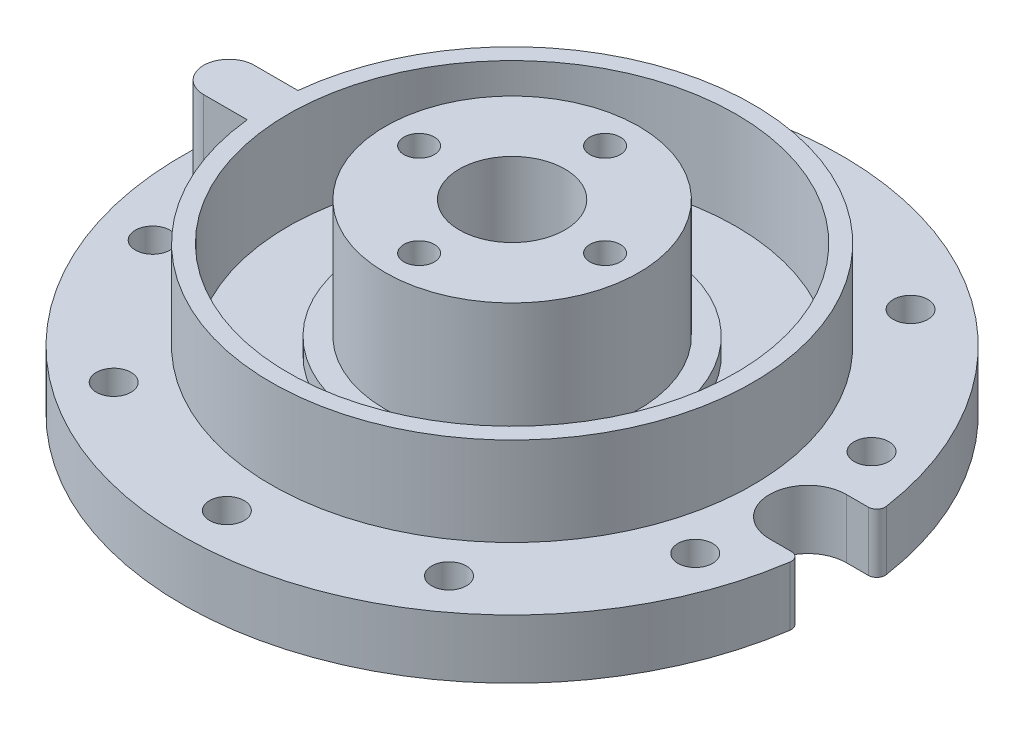
from build123d import *

# Parameters (mm, degrees)
SKETCH1_R                                           = 39
BOSS_EXTRUDE1_DEPTH                                 = 7
SKETCH3_R                                           = 17.5
BOSS_EXTRUDE2_DEPTH                                 = 1
SKETCH4_R                                           = 15
BOSS_EXTRUDE3_DEPTH                                 = 14
SKETCH5_R                                           = 6.25
SKETCH5_R_2                                         = 1.8
CUT_EXTRUDE1_DEPTH                                  = 60.380131357
CSK_FOR_M4_COUNTERSUNK_FLAT_HEAD_SCREW1_D           = 3.5
CSK_FOR_M4_COUNTERSUNK_FLAT_HEAD_SCREW1_CSINK_D     = 9.1
CSK_FOR_M4_COUNTERSUNK_FLAT_HEAD_SCREW1_CSINK_ANGLE = 90
SKETCH7_R                                           = 28.5
SKETCH7_R_2                                         = 26.5
BOSS_EXTRUDE4_DEPTH                                 = 10.5
CUT_EXTRUDE2_START                                  = -1
SKETCH8_R                                           = 26.5
SKETCH8_R_2                                         = 17.5
CUT_EXTRUDE2_DEPTH                                  = 1
SKETCH9_R                                           = 2.05
CUT_EXTRUDE3_DEPTH                                  = 58.157676676
BOSS_EXTRUDE5_DEPTH                                 = 10.5
CUT_EXTRUDE4_DEPTH                                  = 58.157676676
FILLET1_R                                           = 1


with BuildPart() as part:
    # Sketch1 → Boss-Extrude1 (new body)
    with BuildSketch(Plane(origin=(0, 0, 0), x_dir=(1, 0, 0), z_dir=(0, 1, 0))):
        with Locations(Location((0, 0, 0), (0, 0, 270))):
            Circle(SKETCH1_R)
    extrude(amount=BOSS_EXTRUDE1_DEPTH)

    # Sketch3 → Boss-Extrude2 (add)
    with BuildSketch(Plane(origin=(0, 7, 0), x_dir=(1, 0, 0), z_dir=(0, 1, 0))):
        with Locations(Location((0, 0, 0), (0, 0, 270))):
            Circle(SKETCH3_R)
    extrude(amount=BOSS_EXTRUDE2_DEPTH)

    # Sketch4 → Boss-Extrude3 (add)
    with BuildSketch(Plane(origin=(0, 8, 0), x_dir=(1, 0, 0), z_dir=(0, 1, 0))):
        with Locations(Location((0, 0, 0), (0, 0, 270))):
            Circle(SKETCH4_R)
    extrude(amount=BOSS_EXTRUDE3_DEPTH)

    # Sketch5 → Cut-Extrude1 (cut, through all)
    with BuildSketch(Plane(origin=(0, 22, 0), x_dir=(1, 0, 0), z_dir=(0, 1, 0))):
        with Locations(Location((0, 0, 0), (0, 0, 270))):
            Circle(SKETCH5_R)
        with Locations(Location((0, 11, 0), (0, 0, 270))):
            Circle(SKETCH5_R_2)
        with Locations(Location((11, 0, 0), (0, 0, 270))):
            Circle(SKETCH5_R_2)
        with Locations(Location((0, -11, 0), (0, 0, 270))):
            Circle(SKETCH5_R_2)
        with Locations(Location((-11, 0, 0), (0, 0, 270))):
            Circle(SKETCH5_R_2)
    extrude(amount=-CUT_EXTRUDE1_DEPTH, mode=Mode.SUBTRACT)

    # CSK for M4 Countersunk Flat Head Screw1 (through all)
    with Locations(Plane(origin=(11, 0, 0), x_dir=(0, 0, -1), z_dir=(0, -1, 0))):
        with Locations((0, 0), (11, -11), (0, -22), (-11, -11)):
            CounterSinkHole(CSK_FOR_M4_COUNTERSUNK_FLAT_HEAD_SCREW1_D / 2, CSK_FOR_M4_COUNTERSUNK_FLAT_HEAD_SCREW1_CSINK_D / 2, counter_sink_angle=CSK_FOR_M4_COUNTERSUNK_FLAT_HEAD_SCREW1_CSINK_ANGLE)

    # Sketch7 → Boss-Extrude4 (add)
    with BuildSketch(Plane(origin=(0, 7, 0), x_dir=(1, 0, 0), z_dir=(0, 1, 0))):
        with Locations(Location((0, 0, 0), (0, 0, 90))):
            Circle(SKETCH7_R)
        with Locations(Location((0, 0, 0), (0, 0, 90))):
            Circle(SKETCH7_R_2, mode=Mode.SUBTRACT)
    extrude(amount=BOSS_EXTRUDE4_DEPTH)

    # Sketch8 → Cut-Extrude2 (cut)
    with BuildSketch(Plane(origin=(0, 7, 0), x_dir=(1, 0, 0), z_dir=(0, 1, 0)).offset(CUT_EXTRUDE2_START)):
        with Locations(Location((0, 0, 0), (0, 0, 90))):
            Circle(SKETCH8_R)
        with Locations(Location((0, 0, 0), (0, 0, 270))):
            Circle(SKETCH8_R_2, mode=Mode.SUBTRACT)
    extrude(amount=CUT_EXTRUDE2_DEPTH, mode=Mode.SUBTRACT)

    # Sketch9 → Cut-Extrude3 (cut, through all)
    with BuildSketch(Plane(origin=(0, 7, 0), x_dir=(1, 0, 0), z_dir=(0, 1, 0))):
        with Locations(Location((0, 33.75, 0), (0, 0, 270))):
            Circle(SKETCH9_R)
        with Locations(Location((19.837752265, 27.30432356, 0), (0, 0, 270))):
            Circle(SKETCH9_R)
        with Locations(Location((32.098157425, 10.42932356, 0), (0, 0, 270))):
            Circle(SKETCH9_R)
        with Locations(Location((32.098157425, -10.42932356, 0), (0, 0, 270))):
            Circle(SKETCH9_R)
        with Locations(Location((19.837752265, -27.30432356, 0), (0, 0, 270))):
            Circle(SKETCH9_R)
        with Locations(Location((0, -33.75, 0), (0, 0, 270))):
            Circle(SKETCH9_R)
        with Locations(Location((-19.837752265, -27.30432356, 0), (0, 0, 270))):
            Circle(SKETCH9_R)
        with Locations(Location((-32.098157425, -10.42932356, 0), (0, 0, 270))):
            Circle(SKETCH9_R)
        with Locations(Location((-32.098157425, 10.42932356, 0), (0, 0, 270))):
            Circle(SKETCH9_R)
        with Locations(Location((-19.837752265, 27.30432356, 0), (0, 0, 270))):
            Circle(SKETCH9_R)
    extrude(amount=-CUT_EXTRUDE3_DEPTH, mode=Mode.SUBTRACT)

    # Sketch10 → Boss-Extrude5 (add)
    with BuildSketch(Plane(origin=(0, 7, 0), x_dir=(1, 0, 0), z_dir=(0, 1, 0))):
        with BuildLine():
            Line((-33.5, 3), (-28.341665442, 3))
            ThreePointArc((-28.341665442, 3), (-28.5, 0), (-28.341665442, -3))
            Line((-28.341665442, -3), (-33.5, -3))
            ThreePointArc((-33.5, -3), (-36.5, 0), (-33.5, 3))
        make_face()
    extrude(amount=BOSS_EXTRUDE5_DEPTH)

    # Sketch11 → Cut-Extrude4 (cut, through all)
    with BuildSketch(Plane(origin=(0, 7, 0), x_dir=(1, 0, 0), z_dir=(0, 1, 0))):
        with BuildLine():
            Line((35, 4.55), (38.73367398, 4.55))
            ThreePointArc((38.73367398, 4.55), (39, 0), (38.73367398, -4.55))
            Line((38.73367398, -4.55), (35, -4.55))
            ThreePointArc((35, -4.55), (30.45, 0), (35, 4.55))
        make_face()
    extrude(amount=-CUT_EXTRUDE4_DEPTH, mode=Mode.SUBTRACT)

    # Fillet1
    fillet1_edges = [part.edges().sort_by_distance(p)[0] for p in [
        (38.73367398, 3.5, -4.55),
        (38.73367398, 3.5, 4.55),
    ]]
    fillet(fillet1_edges, radius=FILLET1_R)


solid = part.part
